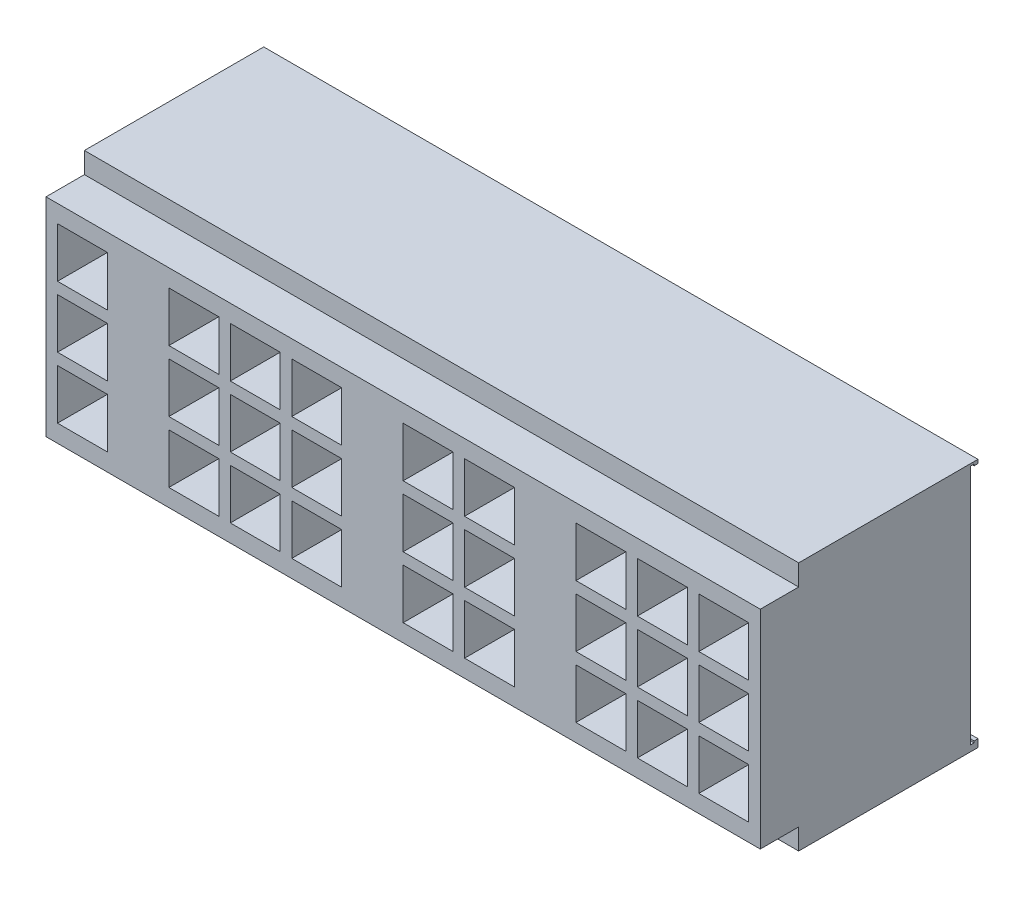
from build123d import *

# Parameters (mm, degrees)
ESQUISSE1_W                     = 186
ESQUISSE1_H                     = 51
BOSS_EXTRU_1_DEPTH              = 20
ESQUISSE7_W                     = 13
ESQUISSE7_H                     = 13
ENL_V_MAT_EXTRU_5_DEPTH         = 91
R_P_TITION_LIN_AIRE5_COUNT      = 3
R_P_TITION_LIN_AIRE5_PITCH      = 16
ESQUISSE8_W                     = 13
ESQUISSE8_H                     = 13
ENL_V_MAT_EXTRU_6_DEPTH         = 103
R_P_TITION_LIN_AIRE6_COUNT      = 3
R_P_TITION_LIN_AIRE6_PITCH      = 16
R_P_TITION_LIN_AIRE6_COUNT_DIR2 = 3
R_P_TITION_LIN_AIRE6_PITCH_DIR2 = 16
ESQUISSE9_W                     = 13
ESQUISSE9_H                     = 13
ENL_V_MAT_EXTRU_7_DEPTH         = 77
R_P_TITION_LIN_AIRE7_COUNT      = 3
R_P_TITION_LIN_AIRE7_PITCH      = 16
R_P_TITION_LIN_AIRE7_COUNT_DIR2 = 2
R_P_TITION_LIN_AIRE7_PITCH_DIR2 = 16
ESQUISSE10_W                    = 13
ESQUISSE10_H                    = 13
ENL_V_MAT_EXTRU_8_DEPTH         = 78
R_P_TITION_LIN_AIRE8_COUNT      = 3
R_P_TITION_LIN_AIRE8_PITCH      = 16
R_P_TITION_LIN_AIRE8_COUNT_DIR2 = 3
R_P_TITION_LIN_AIRE8_PITCH_DIR2 = 16
ESQUISSE14_W                    = 10
ESQUISSE14_H                    = 5
BOSS_EXTRU_3_DEPTH              = 7
ESQUISSE25_W                    = 186
ESQUISSE25_H                    = 20
BOSS_EXTRU_7_DEPTH              = 7
ESQUISSE18_W                    = 186
ESQUISSE18_H                    = 20
BOSS_EXTRU_5_DEPTH              = 7
ESQUISSE16_W                    = 3.3
ESQUISSE16_H                    = 55
ENL_V_MAT_EXTRU_11_DEPTH        = 184
ESQUISSE15_R                    = 1
ENL_V_MAT_EXTRU_10_DEPTH        = 7
ESQUISSE24_W                    = 10
ESQUISSE24_H                    = 2
ENL_V_MAT_EXTRU_12_DEPTH        = 1
ESQUISSE19_W                    = 186
ESQUISSE19_H                    = 2
ESQUISSE19_W_2                  = 2
ESQUISSE19_H_2                  = 61
BOSS_EXTRU_8_DEPTH              = 40
ESQUISSE26_R                    = 1.75
ENL_V_MAT_EXTRU_14_DEPTH        = 30
ENL_V_MAT_EXTRU_16_DEPTH        = 199.896958247
ESQUISSE30_W                    = 1
ESQUISSE30_H                    = 62.033564447
ENL_V_MAT_EXTRU_19_DEPTH        = 185.5


with BuildPart() as part:
    # Esquisse1 → Boss.-Extru.1 (new body)
    with BuildSketch(Plane.XY):
        with Locations((0, -25.5)):
            Rectangle(ESQUISSE1_W, ESQUISSE1_H)
    extrude(amount=BOSS_EXTRU_1_DEPTH)

    # Esquisse7 → Enlèv. mat.-Extru.5 (cut)
    with BuildSketch(Plane.XY.offset(20)):
        with Locations((-83.5, -9.5)):
            Rectangle(ESQUISSE7_W, ESQUISSE7_H)
    enl_v_mat_extru_5 = extrude(amount=-ENL_V_MAT_EXTRU_5_DEPTH, mode=Mode.SUBTRACT)

    # Répétition linéaire5: Enlèv. mat.-Extru.5 ×3
    with Locations(*[(0, -i * R_P_TITION_LIN_AIRE5_PITCH, 0) for i in range(1, R_P_TITION_LIN_AIRE5_COUNT)]):
        add(enl_v_mat_extru_5, mode=Mode.SUBTRACT)

    # Esquisse8 → Enlèv. mat.-Extru.6 (cut)
    with BuildSketch(Plane.XY.offset(20)):
        with Locations((-54.5, -9.5)):
            Rectangle(ESQUISSE8_W, ESQUISSE8_H)
    enl_v_mat_extru_6 = extrude(amount=-ENL_V_MAT_EXTRU_6_DEPTH, mode=Mode.SUBTRACT)

    # Répétition linéaire6: Enl_v. mat.-Extru.6 3 × 3
    with Locations(*[(j * R_P_TITION_LIN_AIRE6_PITCH_DIR2, -i * R_P_TITION_LIN_AIRE6_PITCH, 0) for i in range(R_P_TITION_LIN_AIRE6_COUNT) for j in range(R_P_TITION_LIN_AIRE6_COUNT_DIR2) if (i, j) != (0, 0)]):
        add(enl_v_mat_extru_6, mode=Mode.SUBTRACT)

    # Esquisse9 → Enlèv. mat.-Extru.7 (cut)
    with BuildSketch(Plane.XY.offset(20)):
        with Locations((6.5, -9.5)):
            Rectangle(ESQUISSE9_W, ESQUISSE9_H)
    enl_v_mat_extru_7 = extrude(amount=-ENL_V_MAT_EXTRU_7_DEPTH, mode=Mode.SUBTRACT)

    # Répétition linéaire7: Enl_v. mat.-Extru.7 3 × 2
    with Locations(*[(j * R_P_TITION_LIN_AIRE7_PITCH_DIR2, -i * R_P_TITION_LIN_AIRE7_PITCH, 0) for i in range(R_P_TITION_LIN_AIRE7_COUNT) for j in range(R_P_TITION_LIN_AIRE7_COUNT_DIR2) if (i, j) != (0, 0)]):
        add(enl_v_mat_extru_7, mode=Mode.SUBTRACT)

    # Esquisse10 → Enlèv. mat.-Extru.8 (cut)
    with BuildSketch(Plane.XY.offset(20)):
        with Locations((51.5, -9.5)):
            Rectangle(ESQUISSE10_W, ESQUISSE10_H)
    enl_v_mat_extru_8 = extrude(amount=-ENL_V_MAT_EXTRU_8_DEPTH, mode=Mode.SUBTRACT)

    # Répétition linéaire8: Enl_v. mat.-Extru.8 3 × 3
    with Locations(*[(i * R_P_TITION_LIN_AIRE8_PITCH, -j * R_P_TITION_LIN_AIRE8_PITCH_DIR2, 0) for i in range(R_P_TITION_LIN_AIRE8_COUNT) for j in range(R_P_TITION_LIN_AIRE8_COUNT_DIR2) if (i, j) != (0, 0)]):
        add(enl_v_mat_extru_8, mode=Mode.SUBTRACT)

    # Esquisse14 → Boss.-Extru.3 (add)
    with BuildSketch(Plane.XZ.offset(51)):
        with Locations((-7.663083533, 2.5)):
            Rectangle(ESQUISSE14_W, ESQUISSE14_H)
    extrude(amount=BOSS_EXTRU_3_DEPTH)

    # Esquisse25 → Boss.-Extru.7 (add)
    with BuildSketch(Plane(origin=(0, 0, 0), x_dir=(1, 0, 0), z_dir=(0, 1, 0))):
        with Locations((0, -10)):
            Rectangle(ESQUISSE25_W, ESQUISSE25_H)
    extrude(amount=BOSS_EXTRU_7_DEPTH)

    # Esquisse18 → Boss.-Extru.5 (add)
    with BuildSketch(Plane.XZ.offset(51)):
        with Locations((0, 10)):
            Rectangle(ESQUISSE18_W, ESQUISSE18_H)
    extrude(amount=BOSS_EXTRU_5_DEPTH)

    # Esquisse16 → Enlèv. mat.-Extru.11 (cut)
    with BuildSketch(Plane.ZY.offset(93)):
        with Locations((18.35, -25.5)):
            Rectangle(ESQUISSE16_W, ESQUISSE16_H)
    extrude(amount=-ENL_V_MAT_EXTRU_11_DEPTH, mode=Mode.SUBTRACT)

    # Esquisse15 → Enlèv. mat.-Extru.10 (cut)
    with BuildSketch(Plane(origin=(0, 0, 0), x_dir=(-1, 0, 0), z_dir=(0, 0, -1))):
        with Locations((8.482305804, -42.446555864)):
            Circle(ESQUISSE15_R)
        with Locations((8.482305804, -9.749028666)):
            Circle(ESQUISSE15_R)
        with Locations((68.823038652, -42.446555864)):
            Circle(ESQUISSE15_R)
        with Locations((68.823038652, -9.749028666)):
            Circle(ESQUISSE15_R)
        with Locations((-37.13548256, -42.446555864)):
            Circle(ESQUISSE15_R)
        with Locations((-39.215855023, -11.260648292)):
            Circle(ESQUISSE15_R)
    extrude(amount=-ENL_V_MAT_EXTRU_10_DEPTH, mode=Mode.SUBTRACT)

    # Esquisse24 → Enlèv. mat.-Extru.12 (cut)
    with BuildSketch(Plane(origin=(0, 0, 0), x_dir=(-1, 0, 0), z_dir=(0, 0, -1))):
        with Locations((83.5, -49)):
            Rectangle(ESQUISSE24_W, ESQUISSE24_H)
        with Locations((54.5, -49)):
            Rectangle(ESQUISSE24_W, ESQUISSE24_H)
        with Locations((38.5, -49)):
            Rectangle(ESQUISSE24_W, ESQUISSE24_H)
        with Locations((22.5, -49)):
            Rectangle(ESQUISSE24_W, ESQUISSE24_H)
        with Locations((-6.5, -49)):
            Rectangle(ESQUISSE24_W, ESQUISSE24_H)
        with Locations((-22.5, -49)):
            Rectangle(ESQUISSE24_W, ESQUISSE24_H)
        with Locations((-51.5, -49)):
            Rectangle(ESQUISSE24_W, ESQUISSE24_H)
        with Locations((-67.5, -49)):
            Rectangle(ESQUISSE24_W, ESQUISSE24_H)
        with Locations((-83.5, -49)):
            Rectangle(ESQUISSE24_W, ESQUISSE24_H)
        with Locations((-83.5, -2)):
            Rectangle(ESQUISSE24_W, ESQUISSE24_H)
        with Locations((-67.5, -2)):
            Rectangle(ESQUISSE24_W, ESQUISSE24_H)
        with Locations((-51.5, -2)):
            Rectangle(ESQUISSE24_W, ESQUISSE24_H)
        with Locations((-22.5, -2)):
            Rectangle(ESQUISSE24_W, ESQUISSE24_H)
        with Locations((-6.5, -2)):
            Rectangle(ESQUISSE24_W, ESQUISSE24_H)
        with Locations((22.5, -2)):
            Rectangle(ESQUISSE24_W, ESQUISSE24_H)
        with Locations((38.5, -2)):
            Rectangle(ESQUISSE24_W, ESQUISSE24_H)
        with Locations((54.5, -2)):
            Rectangle(ESQUISSE24_W, ESQUISSE24_H)
        with Locations((83.5, -2)):
            Rectangle(ESQUISSE24_W, ESQUISSE24_H)
    extrude(amount=-ENL_V_MAT_EXTRU_12_DEPTH, mode=Mode.SUBTRACT)

    # Esquisse19 → Boss.-Extru.8 (add)
    with BuildSketch(Plane(origin=(0, 0, 0), x_dir=(-1, 0, 0), z_dir=(0, 0, -1))):
        with Locations((0, -57)):
            Rectangle(ESQUISSE19_W, ESQUISSE19_H)
        with Locations((92, -25.5)):
            Rectangle(ESQUISSE19_W_2, ESQUISSE19_H_2)
        with Locations((0, 6)):
            Rectangle(ESQUISSE19_W, ESQUISSE19_H)
        with Locations((-92, -25.5)):
            Rectangle(ESQUISSE19_W_2, ESQUISSE19_H_2)
    extrude(amount=BOSS_EXTRU_8_DEPTH)

    # Esquisse26 → Enlèv. mat.-Extru.14 (cut)
    with BuildSketch(Plane.ZY.offset(93)):
        with Locations((-25, -25.5)):
            Circle(ESQUISSE26_R)
    extrude(amount=-ENL_V_MAT_EXTRU_14_DEPTH, mode=Mode.SUBTRACT)

    # Esquisse27 → Enlèv. mat.-Extru.16 (cut, through all)
    with BuildSketch(Plane.ZY.offset(93)):
        Polygon((6.7, 7), (6.7, 2), (6.7, 1.55), (16.7, 1.55), (16.7, -52.55), (6.7, -52.55), (6.7, -53), (6.7, -58), (20, -58), (20, 7), align=None)
    extrude(amount=-ENL_V_MAT_EXTRU_16_DEPTH, mode=Mode.SUBTRACT)

    # Esquisse30 → Enlèv. mat.-Extru.19 (cut)
    with BuildSketch(Plane(origin=(93, 0, 0), x_dir=(0, 0, -1), z_dir=(1, 0, 0))):
        Polygon((38, 6.45), (38, -56), (38, -56.45), (39, -56.45), (39, -56), (39, 6.033564447), (39, 6.45), align=None)
        with Locations((39.5, -24.983217776)):
            Rectangle(ESQUISSE30_W, ESQUISSE30_H)
    extrude(amount=-ENL_V_MAT_EXTRU_19_DEPTH, mode=Mode.SUBTRACT)


solid = part.part
